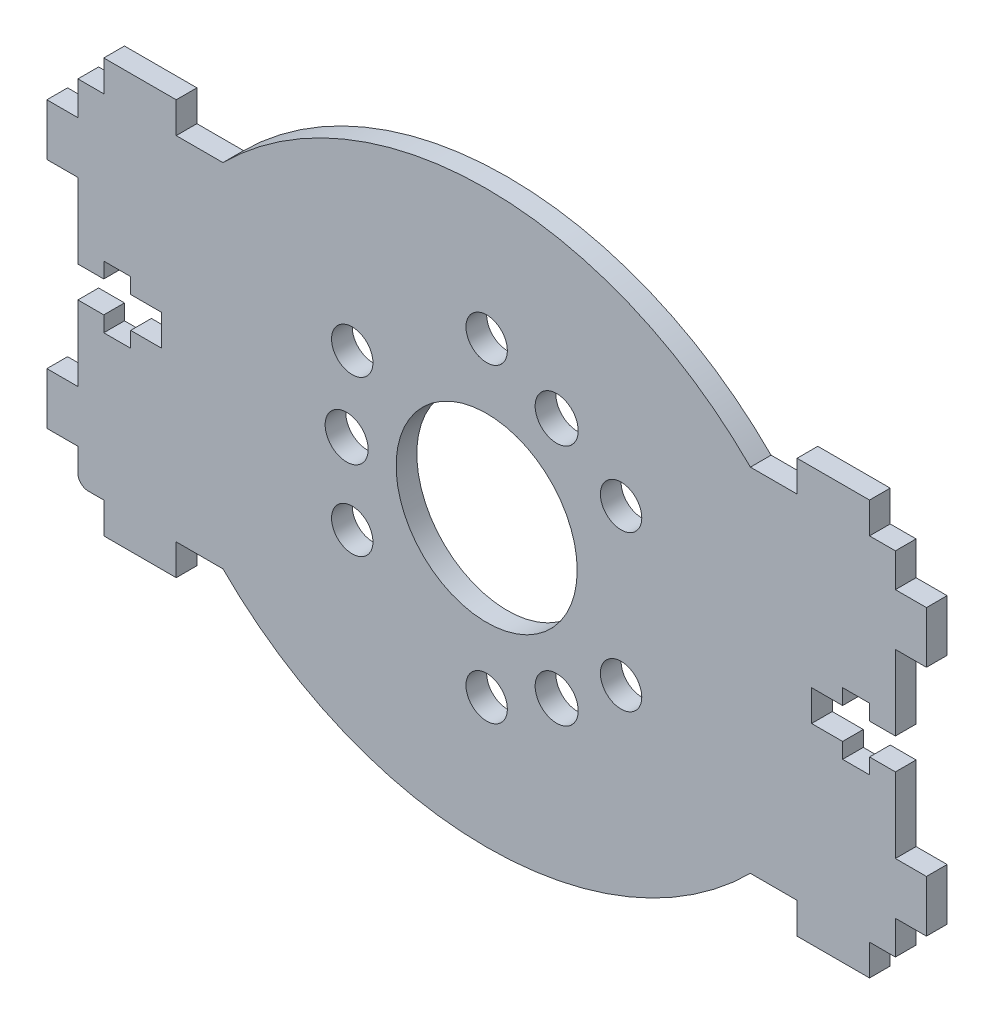
from build123d import *

# Parameters (mm, degrees)
SKETCH_1_R      = 2
SKETCH_1_R_2    = 2.08
SKETCH_1_R_3    = 8.75
EXTRUDE_2_DEPTH = 2


with BuildPart() as part:
    # 草图1 → 凸台-拉伸2 (new body)
    with BuildSketch(Plane.XY):
        with BuildLine():
            Line((-39.5, -13.75), (-39.5, -16))
            ThreePointArc((-39.5, -16), (-39.207106781, -16.707106781), (-38.5, -17))
            Line((-38.5, -17), (-37, -17))
            Line((-37, -17), (-37, -20))
            Line((-37, -20), (-30, -20))
            Line((-30, -20), (-30, -17))
            Line((-30, -17), (-25.488968202, -17))
            ThreePointArc((-25.488968202, -17), (0, -27.55787632), (25.488968202, -17))
            Line((25.488968202, -17), (30, -17))
            Line((30, -17), (30, -20))
            Line((30, -20), (37, -20))
            Line((37, -20), (37, -17))
            Line((37, -17), (39.5, -17))
            Line((39.5, -17), (39.5, -13.75))
            Line((39.5, -13.75), (42.5, -13.75))
            Line((42.5, -13.75), (42.5, -8.75))
            Line((42.5, -8.75), (39.5, -8.75))
            Line((39.5, -8.75), (39.5, -1.5))
            Line((39.5, -1.5), (37, -1.5))
            Line((37, -1.5), (37, -3))
            Line((37, -3), (34.4, -3))
            Line((34.4, -3), (34.4, -1.5))
            Line((34.4, -1.5), (31.4, -1.5))
            Line((31.4, -1.5), (31.4, 1.5))
            Line((31.4, 1.5), (34.4, 1.5))
            Line((34.4, 1.5), (34.4, 3))
            Line((34.4, 3), (37, 3))
            Line((37, 3), (37, 1.5))
            Line((37, 1.5), (39.5, 1.5))
            Line((39.5, 1.5), (39.5, 8.75))
            Line((39.5, 8.75), (42.5, 8.75))
            Line((42.5, 8.75), (42.5, 13.75))
            Line((42.5, 13.75), (39.5, 13.75))
            Line((39.5, 13.75), (39.5, 17))
            Line((39.5, 17), (37, 17))
            Line((37, 17), (37, 20))
            Line((37, 20), (30, 20))
            Line((30, 20), (30, 17))
            Line((30, 17), (25.488968202, 17))
            ThreePointArc((25.488968202, 17), (0, 27.55787632), (-25.488968202, 17))
            Line((-25.488968202, 17), (-30, 17))
            Line((-30, 17), (-30, 20))
            Line((-30, 20), (-37, 20))
            Line((-37, 20), (-37, 17))
            Line((-37, 17), (-39.5, 17))
            Line((-39.5, 17), (-39.5, 13.75))
            Line((-39.5, 13.75), (-42.5, 13.75))
            Line((-42.5, 13.75), (-42.5, 8.75))
            Line((-42.5, 8.75), (-39.5, 8.75))
            Line((-39.5, 8.75), (-39.5, 1.5))
            Line((-39.5, 1.5), (-37, 1.5))
            Line((-37, 1.5), (-37, 3))
            Line((-37, 3), (-34.4, 3))
            Line((-34.4, 3), (-34.4, 1.5))
            Line((-34.4, 1.5), (-31.4, 1.5))
            Line((-31.4, 1.5), (-31.4, -1.5))
            Line((-31.4, -1.5), (-34.4, -1.5))
            Line((-34.4, -1.5), (-34.4, -3))
            Line((-34.4, -3), (-37, -3))
            Line((-37, -3), (-37, -1.5))
            Line((-37, -1.5), (-39.5, -1.5))
            Line((-39.5, -1.5), (-39.5, -8.75))
            Line((-39.5, -8.75), (-42.5, -8.75))
            Line((-42.5, -8.75), (-42.5, -13.75))
            Line((-42.5, -13.75), (-39.5, -13.75))
        make_face()
        with Locations((0, -15)):
            Circle(SKETCH_1_R, mode=Mode.SUBTRACT)
        with Locations((-12.990381057, -7.5)):
            Circle(SKETCH_1_R, mode=Mode.SUBTRACT)
        with Locations((-12.990381057, 7.5)):
            Circle(SKETCH_1_R, mode=Mode.SUBTRACT)
        with Locations((0, 15)):
            Circle(SKETCH_1_R, mode=Mode.SUBTRACT)
        with Locations((12.990381057, 7.5)):
            Circle(SKETCH_1_R, mode=Mode.SUBTRACT)
        with Locations((12.990381057, -7.5)):
            Circle(SKETCH_1_R, mode=Mode.SUBTRACT)
        with Locations((-13.53, 0)):
            Circle(SKETCH_1_R_2, mode=Mode.SUBTRACT)
        with Locations((6.765, 11.717323713)):
            Circle(SKETCH_1_R_2, mode=Mode.SUBTRACT)
        with Locations((6.765, -11.717323713)):
            Circle(SKETCH_1_R_2, mode=Mode.SUBTRACT)
        Circle(SKETCH_1_R_3, mode=Mode.SUBTRACT)
    extrude(amount=EXTRUDE_2_DEPTH)


solid = part.part
